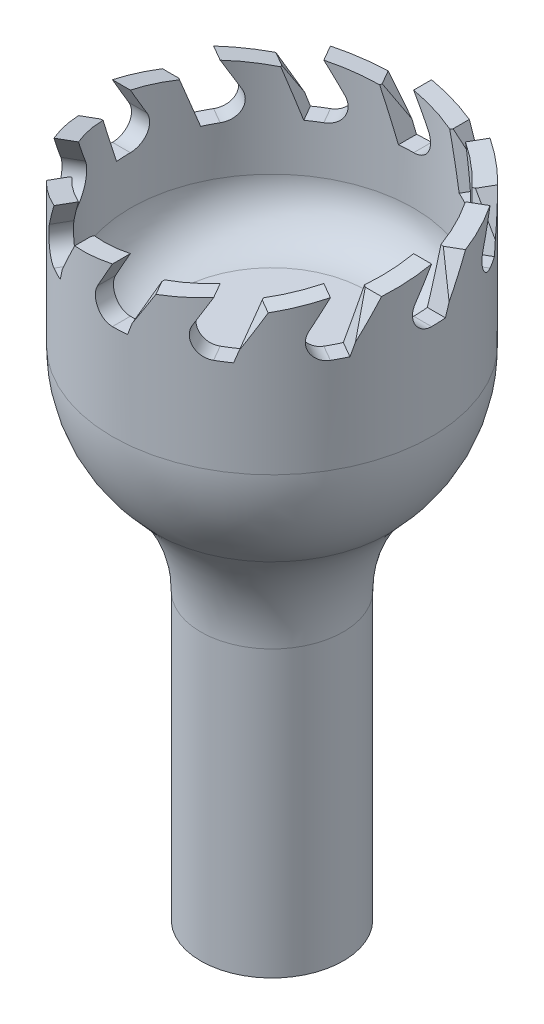
from build123d import *

# Parameters (mm, degrees)
CUT_EXTRUDE1_DEPTH = 19.304
CIRPATTERN2_COUNT  = 12


with BuildPart() as part:
    # Sketch1 → Revolve1 (revolve)
    with BuildSketch(Plane.XY):
        with BuildLine():
            Line((0, 0), (-4.7625, 0))
            Line((-4.7625, 0), (-4.7625, 19.05))
            ThreePointArc((-4.7625, 19.05), (-5.529894723, 22.907953795), (-7.71525, 26.178569096))
            ThreePointArc((-7.71525, 26.178569096), (-9.900605277, 29.449184398), (-10.668, 33.307138193))
            Line((-10.668, 33.307138193), (-10.668, 43.307138193))
            Line((-10.668, 43.307138193), (-9.468, 43.307138193))
            Line((-9.468, 43.307138193), (-9.468, 36.482138193))
            ThreePointArc((-9.468, 36.482138193), (-8.53806403, 34.237074162), (-6.293, 33.307138193))
            Line((-6.293, 33.307138193), (0, 33.307138193))
            Line((0, 33.307138193), (0, 0))
        make_face()
    revolve(axis=Axis((0, 33.307138193, 0), (0, -1, 0)))

    # Sketch2 → Cut-Extrude1 (cut)
    with BuildSketch(Plane.XY):
        with BuildLine():
            Line((0, 43.307138193), (1.04608221, 41.495270656))
            ThreePointArc((1.04608221, 41.495270656), (1.04608221, 40.287358966), (0, 39.68340312))
            Line((0, 39.68340312), (-0.966946132, 39.68340312))
            Line((-0.966946132, 39.68340312), (-2.440808814, 43.792749848))
            Line((-2.440808814, 43.792749848), (4.66649361, 43.792749848))
            Line((4.66649361, 43.792749848), (4.66649361, 39.68340312))
            Line((4.66649361, 39.68340312), (2.934442802, 42.68340312))
            Line((2.934442802, 42.68340312), (0, 43.307138193))
        make_face()
    cut_extrude1 = extrude(amount=-CUT_EXTRUDE1_DEPTH, mode=Mode.SUBTRACT)

    # CirPattern2: Cut-Extrude1 ×12 about axis
    cirpattern2_axis = Axis((0, 36.482138193, 0), (0, 1, 0))
    for i in range(1, CIRPATTERN2_COUNT):
        add(cut_extrude1.rotate(cirpattern2_axis, i * 360 / CIRPATTERN2_COUNT), mode=Mode.SUBTRACT)


solid = part.part
